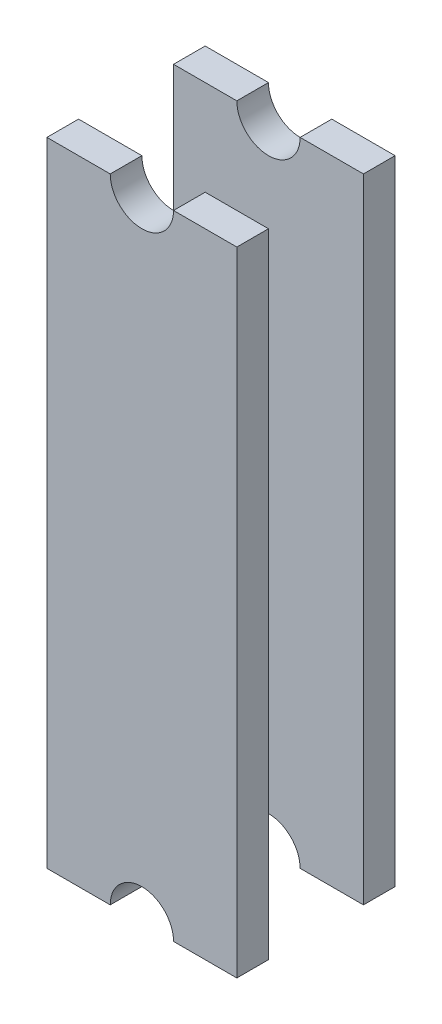
from build123d import *

# Parameters (mm, degrees)
SKETCH1_W           = 60
SKETCH1_H           = 200
BOSS_EXTRUDE1_DEPTH = 10
SKETCH2_W           = 60
SKETCH2_H           = 200
BOSS_EXTRUDE2_DEPTH = 10
SKETCH3_R           = 10
CUT_EXTRUDE1_DEPTH  = 100


with BuildPart() as part:
    # Sketch1 → Boss-Extrude1 (new body)
    with BuildSketch(Plane.XY):
        with Locations((0, 100)):
            Rectangle(SKETCH1_W, SKETCH1_H)
    extrude(amount=BOSS_EXTRUDE1_DEPTH)


with BuildPart() as body_2:
    # Sketch2 → Boss-Extrude2 (new body)
    with BuildSketch(Plane.XY.offset(40)):
        with Locations((0, 100)):
            Rectangle(SKETCH2_W, SKETCH2_H)
    extrude(amount=BOSS_EXTRUDE2_DEPTH)


with BuildPart() as cut_extrude1_tool:
    # Sketch3 → Cut-Extrude1 (new body)
    with BuildSketch(Plane.XY):
        Circle(SKETCH3_R)
        with Locations((0, 200)):
            Circle(SKETCH3_R)
    extrude(amount=CUT_EXTRUDE1_DEPTH)


with BuildPart() as part_1:
    add(part.part)

    # Cut-Extrude1: cut by cut_extrude1_tool
    add(cut_extrude1_tool.part, mode=Mode.SUBTRACT)


with BuildPart() as body_2_1:
    add(body_2.part)

    # Cut-Extrude1: cut by cut_extrude1_tool
    add(cut_extrude1_tool.part, mode=Mode.SUBTRACT)


solid = Compound([part_1.part, body_2_1.part])
